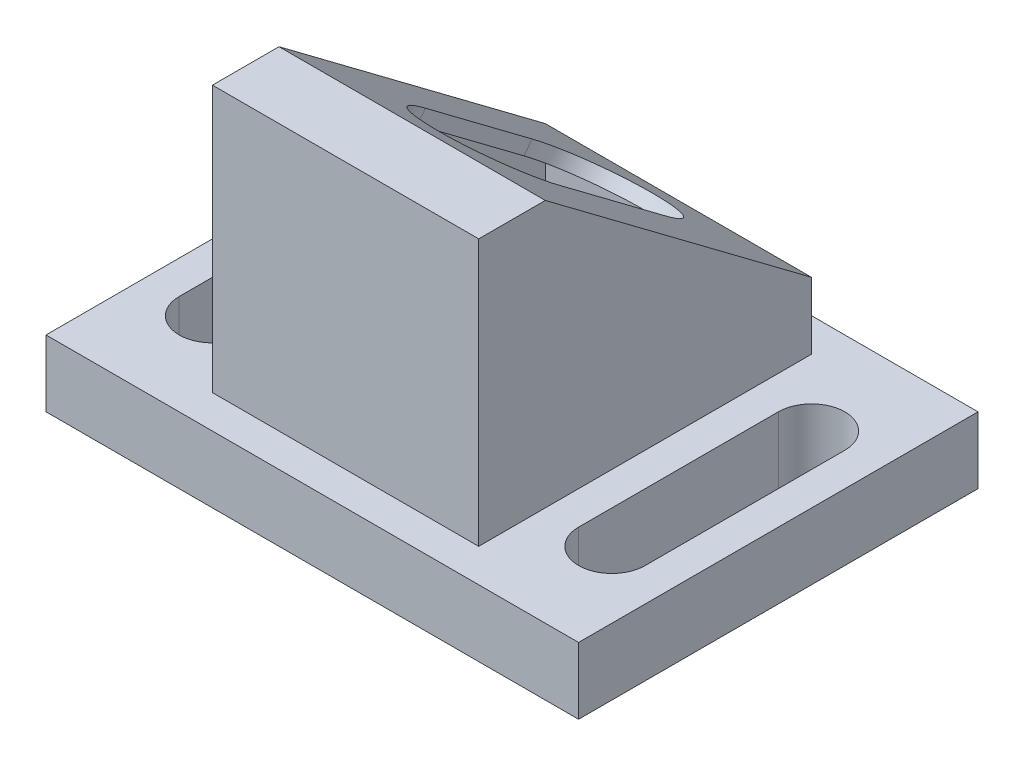
from build123d import *

# Parameters (mm, degrees)
SKETCH1_W           = 101.6
SKETCH1_H           = 76.2
BOSS_EXTRUDE1_DEPTH = 12.7
CUT_EXTRUDE1_DEPTH  = 12.7
BOSS_EXTRUDE2_DEPTH = 25.4
CUT_EXTRUDE3_DEPTH  = 12.7
CUT_EXTRUDE7_DEPTH  = 21.59


with BuildPart() as part:
    # Sketch1 → Boss-Extrude1 (new body)
    with BuildSketch(Plane(origin=(0, 0, 0), x_dir=(1, 0, 0), z_dir=(0, 1, 0))):
        with Locations((50.8, -38.1)):
            Rectangle(SKETCH1_W, SKETCH1_H)
    extrude(amount=BOSS_EXTRUDE1_DEPTH)

    # Sketch4 → Cut-Extrude1 (cut)
    with BuildSketch(Plane(origin=(0, 12.7, 0), x_dir=(1, 0, 0), z_dir=(0, 1, 0))):
        with BuildLine():
            Line((19.05, -19.05), (19.05, -57.15))
            ThreePointArc((19.05, -57.15), (12.7, -63.5), (6.35, -57.15))
            Line((6.35, -57.15), (6.35, -19.05))
            ThreePointArc((6.35, -19.05), (12.7, -12.7), (19.05, -19.05))
        make_face()
        with BuildLine():
            Line((95.25, -19.05), (95.25, -57.15))
            ThreePointArc((95.25, -57.15), (88.9, -63.5), (82.55, -57.15))
            Line((82.55, -57.15), (82.55, -19.05))
            ThreePointArc((82.55, -19.05), (88.9, -12.7), (95.25, -19.05))
        make_face()
    extrude(amount=-CUT_EXTRUDE1_DEPTH, mode=Mode.SUBTRACT)

    # Sketch5 → Boss-Extrude2 (add, symmetric)
    with BuildSketch(Plane(origin=(50.8, 0, 0), x_dir=(0, 0, -1), z_dir=(1, 0, 0))):
        Polygon((-6.35, 12.7), (-6.35, 25.4), (-57.15, 63.5), (-69.85, 63.5), (-69.85, 12.7), align=None)
    extrude(amount=BOSS_EXTRUDE2_DEPTH, both=True)

    # Sketch10 → Cut-Extrude3 (cut)
    with BuildSketch(Plane(origin=(0, 13.208, -9.906), x_dir=(1, 0, 0), z_dir=(0, 0.8, -0.5999999999999999))):
        with BuildLine():
            Line((63.5, -39.37), (63.5, -64.77))
            ThreePointArc((63.5, -64.77), (50.8, -77.47), (38.1, -64.77))
            Line((38.1, -64.77), (38.1, -39.37))
            ThreePointArc((38.1, -39.37), (50.8, -26.67), (63.5, -39.37))
        make_face()
    extrude(amount=-CUT_EXTRUDE3_DEPTH, mode=Mode.SUBTRACT)

    # Sketch12 → Cut-Extrude7 (cut, symmetric)
    with BuildSketch(Plane(origin=(50.8, 0, 0), x_dir=(0, 0, -1), z_dir=(1, 0, 0))):
        Polygon((-10.16, 25.0825), (-56.303333333, 59.69), (-69.596, 59.69), (-69.596, 12.7), (-10.16, 12.7), align=None)
    extrude(amount=CUT_EXTRUDE7_DEPTH, both=True, mode=Mode.SUBTRACT)


solid = part.part
